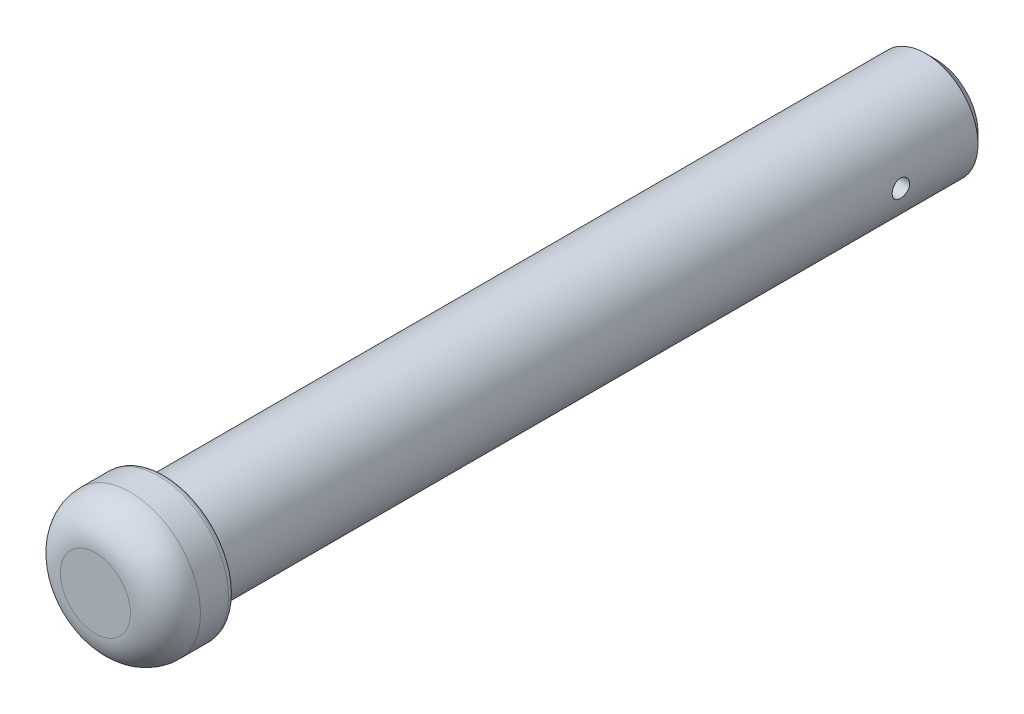
from build123d import *

# Parameters (mm, degrees)
SKETCH1_R               = 15
BOSS_EXTRUDE1_DEPTH     = 220
SKETCH2_R               = 20
BOSS_EXTRUDE2_DEPTH     = 20
FILLET1_R               = 10
FILLET2_R               = 2
CHAMFER1_SIZE           = 3
CUT_EXTRUDE1_DEPTH      = 242.66091948
CUT_EXTRUDE1_DEPTH_BACK = 242.66091948
SKETCH4_R               = 2.5


with BuildPart() as part:
    # Sketch1 → Boss-Extrude1 (new body)
    with BuildSketch(Plane.XY):
        Circle(SKETCH1_R)
    extrude(amount=BOSS_EXTRUDE1_DEPTH)

    # Sketch2 → Boss-Extrude2 (add)
    with BuildSketch(Plane.XY.offset(220)):
        Circle(SKETCH2_R)
    extrude(amount=BOSS_EXTRUDE2_DEPTH)

    # Fillet1
    fillet1_edges = [part.edges().sort_by_distance(p)[0] for p in [
        (-20, 0, 240),
    ]]
    fillet(fillet1_edges, radius=FILLET1_R)

    # Fillet2
    fillet2_edges = [part.edges().sort_by_distance(p)[0] for p in [
        (-15, 0, 220),
        (-20, 0, 220),
    ]]
    fillet(fillet2_edges, radius=FILLET2_R)

    # Chamfer1
    chamfer1_edges = [part.edges().sort_by_distance(p)[0] for p in [
        (-15, 0, 0),
    ]]
    chamfer(chamfer1_edges, length=CHAMFER1_SIZE)

    # Sketch4 → Cut-Extrude1 (cut, two sides: drawn at the far end of the back side and taken through both)
    with BuildSketch(Plane(origin=(0, 0, 0), x_dir=(0, 0, -1), z_dir=(1, 0, 0)).offset(-CUT_EXTRUDE1_DEPTH_BACK)):
        with Locations(Location((-25, 0, 0), (0, 0, 180))):
            Circle(SKETCH4_R)
    extrude(amount=CUT_EXTRUDE1_DEPTH + CUT_EXTRUDE1_DEPTH_BACK, mode=Mode.SUBTRACT)


solid = part.part
